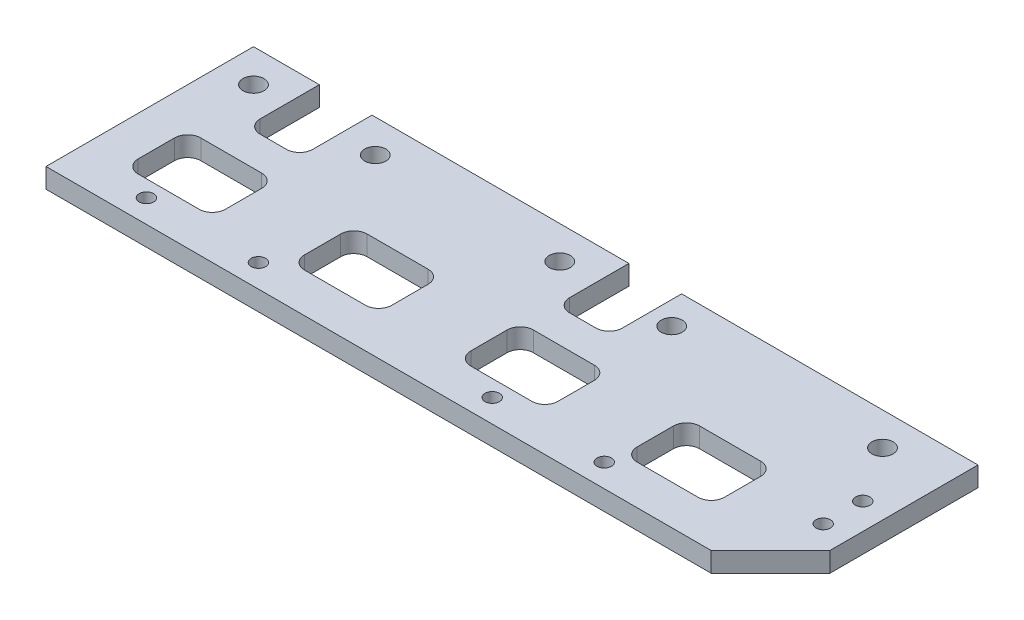
from build123d import *

# Parameters (mm, degrees)
SKETCH1_R      = 1.6
SKETCH1_R_2    = 1.1
SKETCH1_W      = 13.25
SKETCH1_H      = 9.5
EXTRUDE1_DEPTH = 3
FILLET_1_R     = 2


with BuildPart() as part:
    # Sketch1 → Extrude1 (new body)
    with BuildSketch(Plane(origin=(0, 0, 0), x_dir=(1, 0, 0), z_dir=(0, 1, 0))):
        Polygon((30.90824759, 164.13031435), (131.90824759, 164.13031435), (140.90824759, 173.13031435), (140.90824759, 195.63031435), (95.90824759, 195.63031435), (95.90824759, 184.63031435), (87.90824759, 184.63031435), (87.90824759, 195.63031435), (48.90824759, 195.63031435), (48.90824759, 184.63031435), (40.90824759, 184.63031435), (40.90824759, 195.63031435), (30.90824759, 195.63031435), align=None)
        with Locations(Location((131.40824759, 190.63031435, 0), (0, 0, 270))):
            Circle(SKETCH1_R, mode=Mode.SUBTRACT)
        with Locations(Location((99.40824759, 190.63031435, 0), (0, 0, 270))):
            Circle(SKETCH1_R, mode=Mode.SUBTRACT)
        with Locations(Location((82.40824759, 190.63031435, 0), (0, 0, 270))):
            Circle(SKETCH1_R, mode=Mode.SUBTRACT)
        with Locations(Location((54.40824759, 190.63031435, 0), (0, 0, 270))):
            Circle(SKETCH1_R, mode=Mode.SUBTRACT)
        with Locations(Location((35.90824759, 190.63031435, 0), (0, 0, 270))):
            Circle(SKETCH1_R, mode=Mode.SUBTRACT)
        with Locations(Location((112.15824759, 167.63031435, 0), (0, 0, 270))):
            Circle(SKETCH1_R_2, mode=Mode.SUBTRACT)
        with Locations(Location((95.15824759, 167.63031435, 0), (0, 0, 270))):
            Circle(SKETCH1_R_2, mode=Mode.SUBTRACT)
        with Locations(Location((59.65824759, 167.63031435, 0), (0, 0, 270))):
            Circle(SKETCH1_R_2, mode=Mode.SUBTRACT)
        with Locations(Location((42.65824759, 167.63031435, 0), (0, 0, 270))):
            Circle(SKETCH1_R_2, mode=Mode.SUBTRACT)
        with Locations(Location((136.90824759, 176.13031435, 0), (0, 0, 270))):
            Circle(SKETCH1_R_2, mode=Mode.SUBTRACT)
        with Locations(Location((136.90824759, 182.13031435, 0), (0, 0, 270))):
            Circle(SKETCH1_R_2, mode=Mode.SUBTRACT)
        with Locations((119.28324759, 174.88031435)):
            Rectangle(SKETCH1_W, SKETCH1_H, mode=Mode.SUBTRACT)
        with Locations((94.03324759, 174.88031435)):
            Rectangle(SKETCH1_W, SKETCH1_H, mode=Mode.SUBTRACT)
        with Locations((43.53324759, 174.88031435)):
            Rectangle(SKETCH1_W, SKETCH1_H, mode=Mode.SUBTRACT)
        with Locations((68.78324759, 174.88031435)):
            Rectangle(SKETCH1_W, SKETCH1_H, mode=Mode.SUBTRACT)
    extrude(amount=EXTRUDE1_DEPTH)

    # 圆角1
    fillet_1_edges = [part.edges().sort_by_distance(p)[0] for p in [
        (36.90824759, 1.5, -170.13031435),
        (50.15824759, 1.5, -170.13031435),
        (50.15824759, 1.5, -179.63031435),
        (36.90824759, 1.5, -179.63031435),
        (62.15824759, 1.5, -170.13031435),
        (75.40824759, 1.5, -170.13031435),
        (75.40824759, 1.5, -179.63031435),
        (62.15824759, 1.5, -179.63031435),
        (40.90824759, 1.5, -184.63031435),
        (48.90824759, 1.5, -184.63031435),
        (87.90824759, 1.5, -184.63031435),
        (95.90824759, 1.5, -184.63031435),
        (112.65824759, 1.5, -179.63031435),
        (112.65824759, 1.5, -170.13031435),
        (125.90824759, 1.5, -170.13031435),
        (125.90824759, 1.5, -179.63031435),
        (87.40824759, 1.5, -179.63031435),
        (87.40824759, 1.5, -170.13031435),
        (100.65824759, 1.5, -170.13031435),
        (100.65824759, 1.5, -179.63031435),
    ]]
    fillet(fillet_1_edges, radius=FILLET_1_R)


solid = part.part
